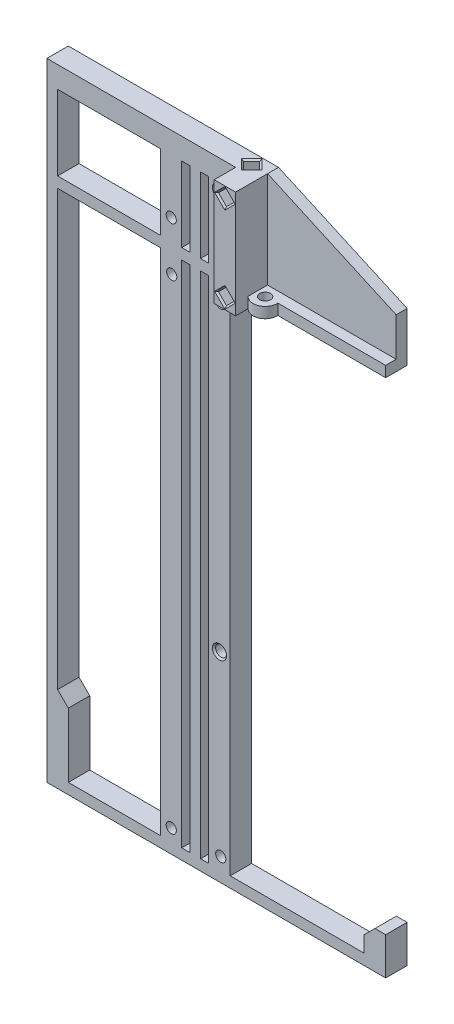
from build123d import *

# Parameters (mm, degrees)
BOSS_EXTRUDE1_START                    = -9.525
SKETCH1_W                              = 2.158991534
SKETCH1_H                              = 29.633333333
SKETCH1_W_2                            = 40.548965045
SKETCH1_W_3                            = 3.220517478
SKETCH1_W_4                            = 3.220517477
SKETCH1_H_2                            = 201.083333334
BOSS_EXTRUDE1_DEPTH                    = 8.466666667
BOSS_EXTRUDE2_DEPTH                    = 4.318
SKETCH16_W                             = 8.466666666
SKETCH16_H                             = 42.333333333
BOSS_EXTRUDE3_DEPTH                    = 8.466666667
SKETCH18_R                             = 4.7625
BOSS_EXTRUDE4_DEPTH                    = 4.233333333
F_18_0_1695_DIAMETER_HOLE3_D           = 4.3053
F_18_0_1695_DIAMETER_HOLE3_DEPTH       = 4.233333333
F_18_0_1695_DIAMETER_HOLE1_D           = 4.3053
F_18_0_1695_DIAMETER_HOLE1_CSINK_D     = 5.5753
F_18_0_1695_DIAMETER_HOLE1_CSINK_ANGLE = 90
BOTTOM_PINS_DEPTH                      = 6.35
REAR_PINS_DEPTH                        = 6.35
LEFT_PINS_DEPTH                        = 6.35
CUT_EXTRUDE3_DEPTH                     = 6.35
CHAMFER2_SIZE                          = 0.635
F_18_0_1695_DIAMETER_HOLE2_D           = 4.3053
F_18_0_1695_DIAMETER_HOLE2_DEPTH       = 8.382
F_18_0_1695_DIAMETER_HOLE2_CSINK_D     = 5.5753
F_18_0_1695_DIAMETER_HOLE2_CSINK_ANGLE = 90
F_18_0_1695_DIAMETER_HOLE2_TIP         = 1.293442612


with BuildPart() as part:
    # Sketch1 → Boss-Extrude1 (new body)
    with BuildSketch(Plane.XY.offset(BOSS_EXTRUDE1_START)):
        Polygon((47.413333333, 127), (130.428991533, 127), (130.428991533, 88.9), (181.228991533, 88.9), (181.228991533, 84.666666667), (119.803333333, 84.666666667), (119.803333333, -116.416666667), (172.762324867, -116.416666667), (172.762324867, -110.066666667), (176.9956582, -105.833333333), (181.228991533, -105.833333333), (181.228991533, -120.65), (47.413333333, -120.65), align=None)
        with Locations((120.8828291, 103.716666667)):
            Rectangle(SKETCH1_W, SKETCH1_H, mode=Mode.SUBTRACT)
        Polygon((55.88, -116.416666667), (55.88, -91.016666667), (51.646666667, -86.783333333), (51.646666667, 84.666666667), (92.195631712, 84.666666667), (92.195631712, -116.416666667), align=None, mode=Mode.SUBTRACT)
        with Locations((71.921149189, 103.716666667)):
            Rectangle(SKETCH1_W_2, SKETCH1_H, mode=Mode.SUBTRACT)
        with Locations((109.726407928, 103.716666667)):
            Rectangle(SKETCH1_W_3, SKETCH1_H, mode=Mode.SUBTRACT)
        with Locations((102.272557118, -15.875)):
            Rectangle(SKETCH1_W_4, SKETCH1_H_2, mode=Mode.SUBTRACT)
        with Locations((102.272557118, 103.716666667)):
            Rectangle(SKETCH1_W_4, SKETCH1_H, mode=Mode.SUBTRACT)
        with Locations((109.726407928, -15.875)):
            Rectangle(SKETCH1_W_3, SKETCH1_H_2, mode=Mode.SUBTRACT)
    extrude(amount=-BOSS_EXTRUDE1_DEPTH)

    # Sketch9 → Boss-Extrude2 (add)
    with BuildSketch(Plane.XY.offset(-17.991666667)):
        Polygon((181.228991533, 88.9), (130.428991533, 88.9), (130.428991533, 127), (181.228991533, 104.14), align=None)
    extrude(amount=BOSS_EXTRUDE2_DEPTH)

    # Sketch16 → Boss-Extrude3 (add)
    with BuildSketch(Plane.XY.offset(-9.525)):
        with Locations((126.1956582, 105.833333334)):
            Rectangle(SKETCH16_W, SKETCH16_H)
    extrude(amount=BOSS_EXTRUDE3_DEPTH)

    # Sketch18 → Boss-Extrude4 (add)
    with BuildSketch(Plane(origin=(0, 84.666666667, 0), x_dir=(-1, 0, 0), z_dir=(0, -1, 0))):
        with Locations((-133.889, 9.251666559)):
            Circle(SKETCH18_R)
    extrude(amount=-BOSS_EXTRUDE4_DEPTH)

    # #18 (0.1695) Diameter Hole3
    with Locations(Plane(origin=(0, 88.9, 0), x_dir=(1, 0, 0), z_dir=(0, 1, 0))):
        with Locations((133.889, 9.251666559)):
            Hole(F_18_0_1695_DIAMETER_HOLE3_D / 2, depth=F_18_0_1695_DIAMETER_HOLE3_DEPTH)

    # #18 (0.1695) Diameter Hole1 (through all)
    with Locations(Plane.XY.offset(-9.525)):
        with Locations((115.57, 115.57), (115.57, -41.91)):
            CounterSinkHole(F_18_0_1695_DIAMETER_HOLE1_D / 2, F_18_0_1695_DIAMETER_HOLE1_CSINK_D / 2, counter_sink_angle=F_18_0_1695_DIAMETER_HOLE1_CSINK_ANGLE)

    # Sketch2 → bottom pins (cut)
    with BuildSketch(Plane.XZ.offset(120.65)):
        Polygon((173.8206582, -13.758333333), (176.9956582, -10.583333333), (180.1706582, -13.758333333), (176.9956582, -16.933333333), align=None)
        Polygon((48.471666667, -13.758333333), (51.646666667, -10.583333333), (54.821666667, -13.758333333), (51.646666667, -16.933333333), align=None)
    extrude(amount=-BOTTOM_PINS_DEPTH, mode=Mode.SUBTRACT)

    # Sketch3 → rear pins (cut)
    with BuildSketch(Plane.ZY.offset(-47.413333333)):
        Polygon((-16.933333333, 122.766666667), (-13.758333333, 125.941666667), (-10.583333333, 122.766666667), (-13.758333333, 119.591666667), align=None)
        Polygon((-16.933333333, -97.79), (-13.758333333, -94.615), (-10.583333333, -97.79), (-13.758333333, -100.965), align=None)
    extrude(amount=-REAR_PINS_DEPTH, mode=Mode.SUBTRACT)

    # Sketch8 → left pins (cut)
    with BuildSketch(Plane.XY.offset(-1.058333333)):
        Polygon((123.0206582, 88.9), (126.1956582, 92.075), (129.3706582, 88.9), (126.1956582, 85.725), align=None)
        Polygon((123.0206582, 122.766666667), (126.1956582, 125.941666667), (129.3706582, 122.766666667), (126.1956582, 119.591666667), align=None)
    extrude(amount=-LEFT_PINS_DEPTH, mode=Mode.SUBTRACT)

    # Sketch24 → Cut-Extrude3 (cut)
    with BuildSketch(Plane(origin=(0, 127, 0), x_dir=(1, 0, 0), z_dir=(0, 1, 0))):
        Polygon((120.903991533, 13.758333333), (124.078991533, 16.933333333), (127.253991533, 13.758333333), (124.078991533, 10.583333333), align=None)
    extrude(amount=-CUT_EXTRUDE3_DEPTH, mode=Mode.SUBTRACT)

    # Chamfer2
    chamfer2_edges = [part.edges().sort_by_distance(p)[0] for p in [
        (175.4081582, -114.3, -15.345833333),
        (175.4081582, -114.3, -12.170833333),
        (178.5831582, -114.3, -12.170833333),
        (178.5831582, -114.3, -15.345833333),
        (175.4081582, -120.65, -15.345833333),
        (178.5831582, -120.65, -15.345833333),
        (178.5831582, -120.65, -12.170833333),
        (175.4081582, -120.65, -12.170833333),
        (50.059166667, -114.3, -15.345833333),
        (50.059166667, -114.3, -12.170833333),
        (53.234166667, -114.3, -12.170833333),
        (53.234166667, -114.3, -15.345833333),
        (50.059166667, -120.65, -15.345833333),
        (53.234166667, -120.65, -15.345833333),
        (53.234166667, -120.65, -12.170833333),
        (50.059166667, -120.65, -12.170833333),
        (53.763333333, 121.179166667, -15.345833333),
        (53.763333333, 124.354166667, -15.345833333),
        (53.763333333, 124.354166667, -12.170833333),
        (53.763333333, 121.179166667, -12.170833333),
        (47.413333333, 121.179166667, -15.345833333),
        (47.413333333, 121.179166667, -12.170833333),
        (47.413333333, 124.354166667, -12.170833333),
        (47.413333333, 124.354166667, -15.345833333),
        (53.763333333, -99.3775, -15.345833333),
        (53.763333333, -96.2025, -15.345833333),
        (53.763333333, -96.2025, -12.170833333),
        (53.763333333, -99.3775, -12.170833333),
        (47.413333333, -99.3775, -15.345833333),
        (47.413333333, -99.3775, -12.170833333),
        (47.413333333, -96.2025, -12.170833333),
        (47.413333333, -96.2025, -15.345833333),
        (124.6081582, 87.3125, -7.408333333),
        (124.6081582, 90.4875, -7.408333333),
        (127.7831582, 90.4875, -7.408333333),
        (127.7831582, 87.3125, -7.408333333),
        (124.6081582, 87.3125, -1.058333333),
        (127.7831582, 87.3125, -1.058333333),
        (127.7831582, 90.4875, -1.058333333),
        (124.6081582, 90.4875, -1.058333333),
        (124.6081582, 121.179166667, -7.408333333),
        (124.6081582, 124.354166667, -7.408333333),
        (127.7831582, 124.354166667, -7.408333333),
        (127.7831582, 121.179166667, -7.408333333),
        (124.6081582, 121.179166667, -1.058333333),
        (127.7831582, 121.179166667, -1.058333333),
        (127.7831582, 124.354166667, -1.058333333),
        (124.6081582, 124.354166667, -1.058333333),
        (122.491491533, 120.65, -12.170833333),
        (122.491491533, 120.65, -15.345833333),
        (125.666491533, 120.65, -15.345833333),
        (125.666491533, 120.65, -12.170833333),
        (122.491491533, 127, -12.170833333),
        (125.666491533, 127, -12.170833333),
        (125.666491533, 127, -15.345833333),
        (122.491491533, 127, -15.345833333),
    ]]
    chamfer(chamfer2_edges, length=CHAMFER2_SIZE)

    # #18 (0.1695) Diameter Hole2
    with Locations(Plane(origin=(0, 0, -17.991666667), x_dir=(-1, 0, 0), z_dir=(0, 0, -1))):
        with Locations((-116.077975238, 97.155), (-96.527983128, 97.155), (-96.727984128, 77.805001), (-116.077983128, 77.605), (-116.077983128, -111.625), (-96.527983128, -111.625)):
            CounterSinkHole(F_18_0_1695_DIAMETER_HOLE2_D / 2, F_18_0_1695_DIAMETER_HOLE2_CSINK_D / 2, depth=F_18_0_1695_DIAMETER_HOLE2_DEPTH, counter_sink_angle=F_18_0_1695_DIAMETER_HOLE2_CSINK_ANGLE)
            with Locations((0, 0, -(F_18_0_1695_DIAMETER_HOLE2_DEPTH + F_18_0_1695_DIAMETER_HOLE2_TIP / 2))):  # 118° drill point
                Cone(0, F_18_0_1695_DIAMETER_HOLE2_D / 2, F_18_0_1695_DIAMETER_HOLE2_TIP, mode=Mode.SUBTRACT)


solid = part.part
